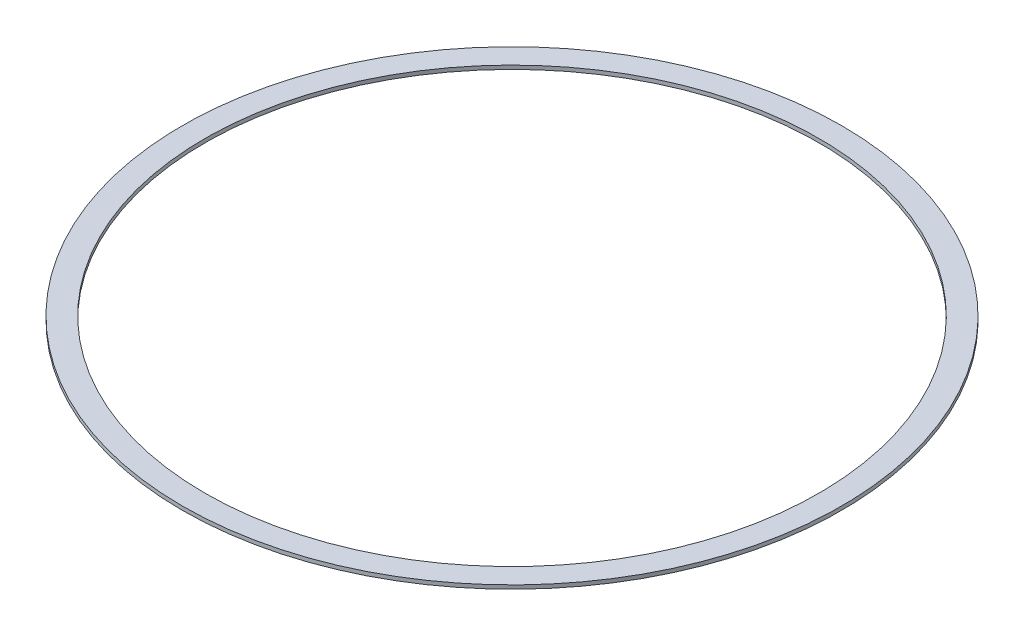
from build123d import *

# Parameters (mm, degrees)
SKETCH1_R           = 221.9579
SKETCH1_R_2         = 206.8449
BOSS_EXTRUDE1_DEPTH = 2.54


with BuildPart() as part:
    # Sketch1 → Boss-Extrude1 (new body)
    with BuildSketch(Plane(origin=(0, 0, 0), x_dir=(1, 0, 0), z_dir=(0, 1, 0))):
        with Locations(Location((0, 0, 0), (0, 0, 270))):
            Circle(SKETCH1_R)
        with Locations(Location((0, 0, 0), (0, 0, 270))):
            Circle(SKETCH1_R_2, mode=Mode.SUBTRACT)
    extrude(amount=BOSS_EXTRUDE1_DEPTH)


solid = part.part
